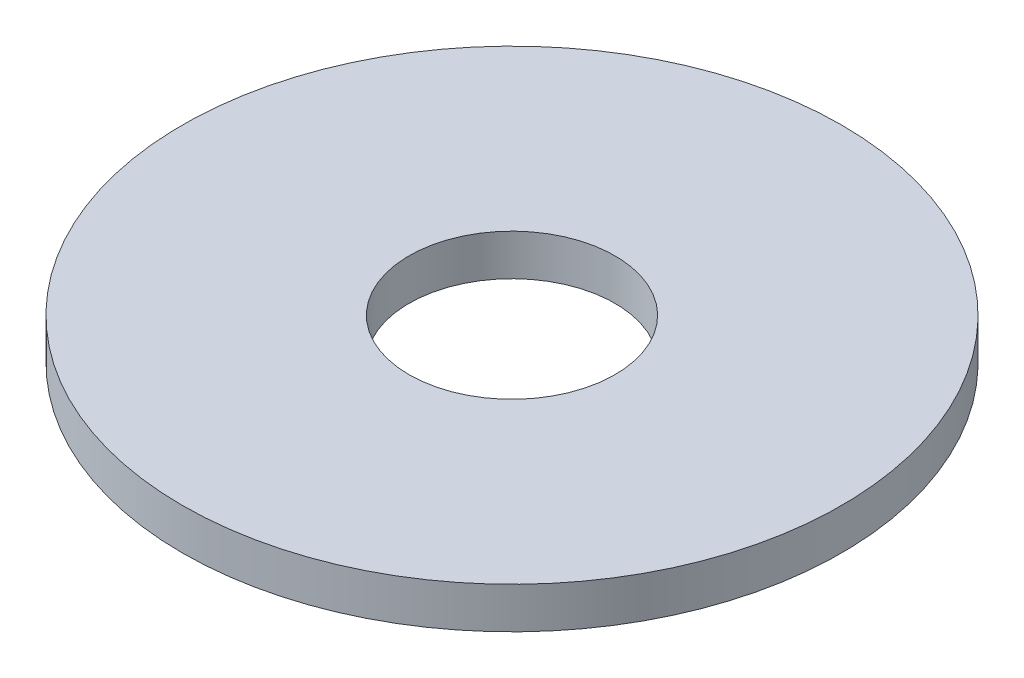
from build123d import *

# Parameters (mm, degrees)
SKETCH1_R           = 8
SKETCH1_R_2         = 2.125
BOSS_EXTRUDE1_DEPTH = 1
SKETCH2_R           = 2.5
CUT_EXTRUDE1_DEPTH  = 10


with BuildPart() as part:
    # Sketch1 → Boss-Extrude1 (new body)
    with BuildSketch(Plane(origin=(0, 0, 0), x_dir=(1, 0, 0), z_dir=(0, 1, 0))):
        with Locations(Location((0, 0, 0), (0, 0, 270))):
            Circle(SKETCH1_R)
        with Locations(Location((0, 0, 0), (0, 0, 270))):
            Circle(SKETCH1_R_2, mode=Mode.SUBTRACT)
    extrude(amount=BOSS_EXTRUDE1_DEPTH)

    # Sketch2 → Cut-Extrude1 (cut)
    with BuildSketch(Plane(origin=(0, 1, 0), x_dir=(1, 0, 0), z_dir=(0, 1, 0))):
        with Locations(Location((0, 0, 0), (0, 0, 270))):
            Circle(SKETCH2_R)
    extrude(amount=-CUT_EXTRUDE1_DEPTH, mode=Mode.SUBTRACT)


solid = part.part
